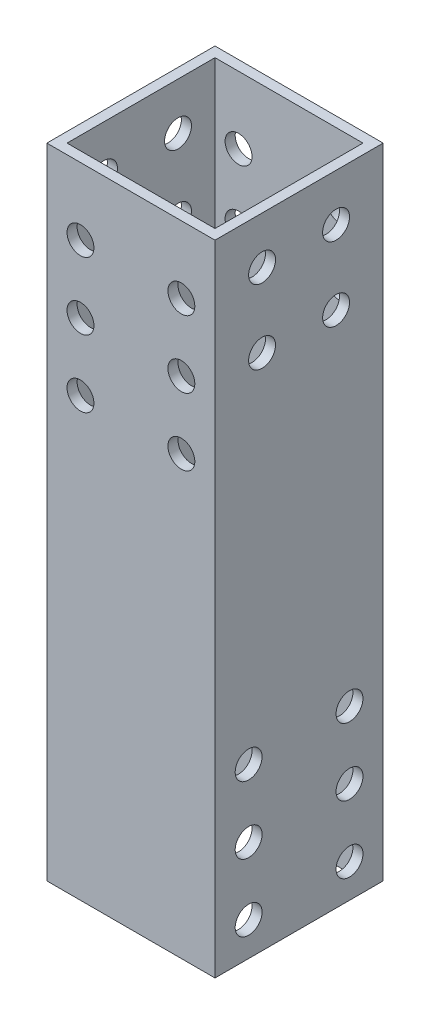
from build123d import *

# Parameters (mm, degrees)
BOSS_EXTRUDE1_DEPTH      = 47.5
BOSS_EXTRUDE1_DEPTH_BACK = 47.5
SKETCH3_W                = 25
SKETCH3_H                = 25
SKETCH3_W_2              = 22
SKETCH3_H_2              = 22
SKETCH6_R                = 2
CUT_EXTRUDE3_DEPTH       = 25
SKETCH7_R                = 2
CUT_EXTRUDE4_DEPTH       = 25
SKETCH8_R                = 2
CUT_EXTRUDE5_DEPTH       = 25


with BuildPart() as part:
    # Sketch3 → Boss-Extrude1 (new, two sides: drawn at the far end of the back side and taken through both)
    with BuildSketch(Plane(origin=(0, 0, 0), x_dir=(1, 0, 0), z_dir=(0, 1, 0)).offset(-BOSS_EXTRUDE1_DEPTH_BACK)):
        Rectangle(SKETCH3_W, SKETCH3_H)
        Rectangle(SKETCH3_W_2, SKETCH3_H_2, mode=Mode.SUBTRACT)
    extrude(amount=BOSS_EXTRUDE1_DEPTH + BOSS_EXTRUDE1_DEPTH_BACK)

    # Sketch6 → Cut-Extrude3 (cut)
    with BuildSketch(Plane(origin=(12.5, 0, 0), x_dir=(0, 0, -1), z_dir=(1, 0, 0))):
        with Locations((7.5, -42.5)):
            Circle(SKETCH6_R)
        with Locations((7.5, -22.5)):
            Circle(SKETCH6_R)
        with Locations((-7.5, -42.5)):
            Circle(SKETCH6_R)
        with Locations((-7.5, -22.5)):
            Circle(SKETCH6_R)
        with Locations((7.5, -32.5)):
            Circle(SKETCH6_R)
        with Locations((-7.5, -32.5)):
            Circle(SKETCH6_R)
    extrude(amount=-CUT_EXTRUDE3_DEPTH, mode=Mode.SUBTRACT)

    # Sketch7 → Cut-Extrude4 (cut)
    with BuildSketch(Plane(origin=(0, 0, -12.5), x_dir=(-1, 0, 0), z_dir=(0, 0, -1))):
        with Locations((7.5, 37.5)):
            Circle(SKETCH7_R)
        with Locations((7.5, 27.5)):
            Circle(SKETCH7_R)
        with Locations((-7.5, 37.5)):
            Circle(SKETCH7_R)
        with Locations((-7.5, 27.5)):
            Circle(SKETCH7_R)
        with Locations((-7.5, 17.5)):
            Circle(SKETCH7_R)
        with Locations((7.5, 17.5)):
            Circle(SKETCH7_R)
    extrude(amount=-CUT_EXTRUDE4_DEPTH, mode=Mode.SUBTRACT)

    # Sketch8 → Cut-Extrude5 (cut)
    with BuildSketch(Plane(origin=(12.5, 0, 0), x_dir=(0, 0, -1), z_dir=(1, 0, 0))):
        with Locations((5.5, 40.5)):
            Circle(SKETCH8_R)
        with Locations((5.5, 29.5)):
            Circle(SKETCH8_R)
        with Locations((-5.5, 29.5)):
            Circle(SKETCH8_R)
        with Locations((-5.5, 40.5)):
            Circle(SKETCH8_R)
    extrude(amount=-CUT_EXTRUDE5_DEPTH, mode=Mode.SUBTRACT)


solid = part.part
